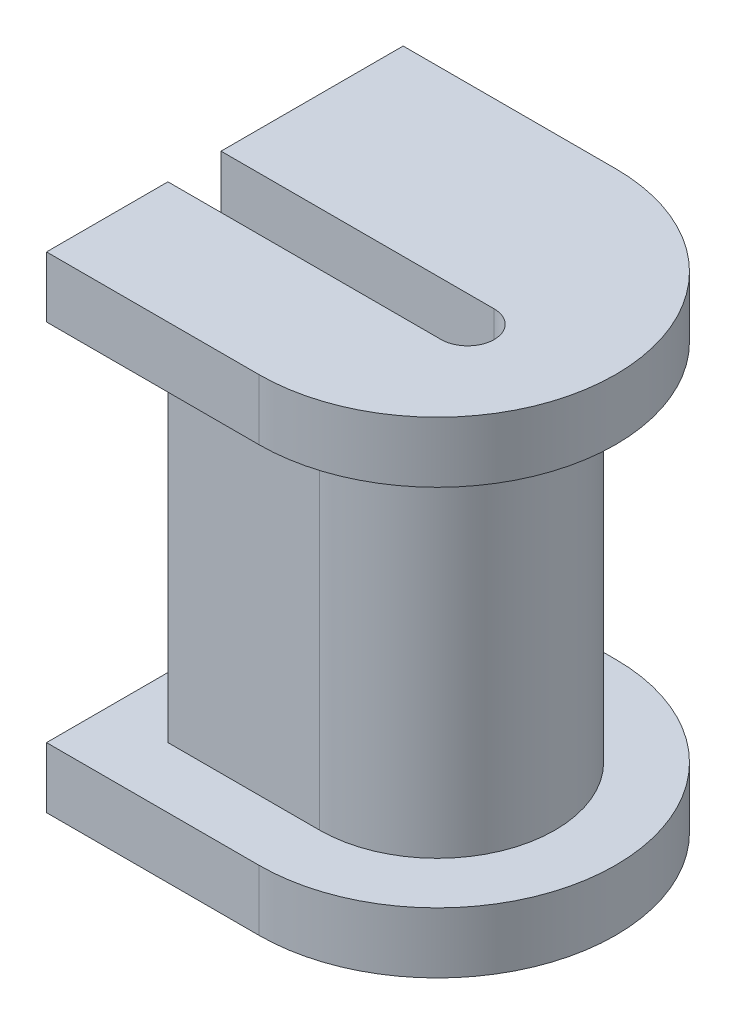
from build123d import *

# Parameters (mm, degrees)
BOSS_EXTRUDE1_DEPTH = 6
BOSS_EXTRUDE2_START = 2
BOSS_EXTRUDE2_DEPTH = 2


with BuildPart() as part:
    # Sketch1 → Boss-Extrude1 (new, symmetric)
    with BuildSketch(Plane(origin=(0, 0, 0), x_dir=(1, 0, 0), z_dir=(0, 1, 0))):
        with BuildLine():
            Line((0, 0), (7, 0))
            ThreePointArc((7, 0), (7.875, -0.875), (7, -1.75))
            Line((7, -1.75), (0, -1.75))
            Line((0, -1.75), (0, -3.75))
            Line((0, -3.75), (5, -3.75))
            ThreePointArc((5, -3.75), (8.875, 0.125), (5, 4))
            Line((5, 4), (0, 4))
            Line((0, 4), (0, 0))
        make_face()
    extrude(amount=BOSS_EXTRUDE1_DEPTH, both=True)

    # Sketch2 → Boss-Extrude2 (add)
    with BuildSketch(Plane(origin=(0, 6, 0), x_dir=(1, 0, 0), z_dir=(0, 1, 0)).offset(BOSS_EXTRUDE2_START)):
        with BuildLine():
            Line((5, 6), (-2, 6))
            Line((-2, 6), (-2, 0))
            Line((-2, 0), (7, 0))
            ThreePointArc((7, 0), (7.875, -0.875), (7, -1.75))
            Line((7, -1.75), (-2, -1.75))
            Line((-2, -1.75), (-2, -5.75))
            Line((-2, -5.75), (5, -5.75))
            ThreePointArc((5, -5.75), (10.875, 0.125), (5, 6))
        make_face()
    boss_extrude2 = extrude(amount=-BOSS_EXTRUDE2_DEPTH)

    # Mirror1: Boss-Extrude2 across plane
    add(boss_extrude2.mirror(Plane.ZX))


solid = part.part
